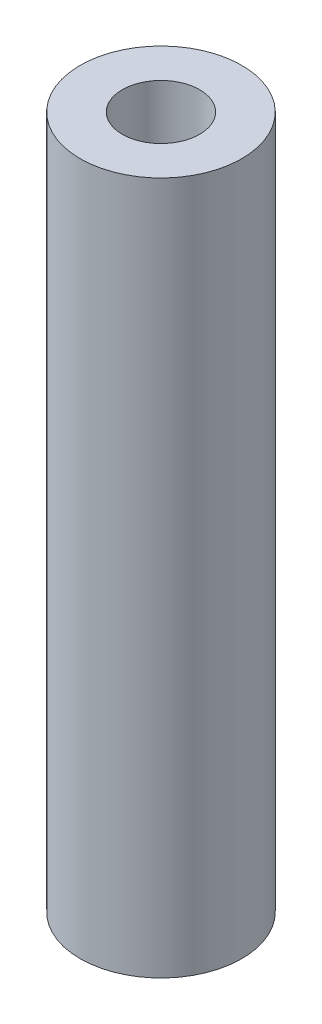
from build123d import *

# Parameters (mm, degrees)
SKETCH1_R           = 3.5
SKETCH1_R_2         = 1.675
BOSS_EXTRUDE1_DEPTH = 30


with BuildPart() as part:
    # Sketch1 → Boss-Extrude1 (new body)
    with BuildSketch(Plane(origin=(0, 0, 0), x_dir=(1, 0, 0), z_dir=(0, 1, 0))):
        with Locations(Location((0, 0, 0), (0, 0, 270))):
            Circle(SKETCH1_R)
        with Locations(Location((0, 0, 0), (0, 0, 270))):
            Circle(SKETCH1_R_2, mode=Mode.SUBTRACT)
    extrude(amount=BOSS_EXTRUDE1_DEPTH)


solid = part.part
